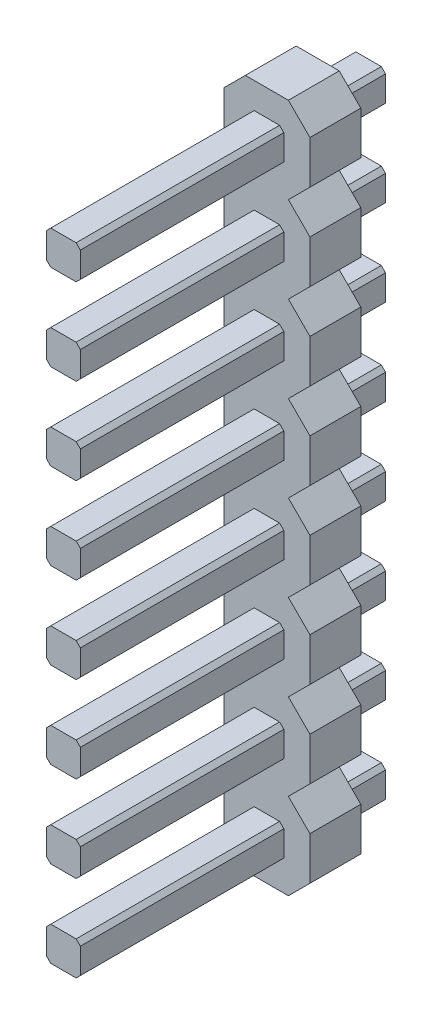
from build123d import *

# Parameters (mm, degrees)
BOSS_EXTRUDE1_DEPTH      = 1.5
BOSS_EXTRUDE2_DEPTH      = 6
BOSS_EXTRUDE2_DEPTH_BACK = 3


with BuildPart() as part:
    # Sketch1 → Boss-Extrude1 (new body)
    with BuildSketch(Plane.XY):
        Polygon((-0.635, 10.16), (0.635, 10.16), (1.27, 9.525), (1.27, 8.255), (0.635, 7.62), (1.27, 6.985), (1.27, 5.715), (0.635, 5.08), (1.27, 4.445), (1.27, 3.175), (0.635, 2.54), (1.27, 1.905), (1.27, 0.635), (0.635, 0), (1.27, -0.635), (1.27, -1.905), (0.635, -2.54), (1.27, -3.175), (1.27, -4.445), (0.635, -5.08), (1.27, -5.715), (1.27, -6.985), (0.635, -7.62), (1.27, -8.255), (1.27, -9.525), (0.635, -10.16), (-0.635, -10.16), (-1.27, -9.525), (-1.27, -8.255), (-0.635, -7.62), (-1.27, -6.985), (-1.27, -5.715), (-0.635, -5.08), (-1.27, -4.445), (-1.27, -3.175), (-0.635, -2.54), (-1.27, -1.905), (-1.27, -0.635), (-0.635, 0), (-1.27, 0.635), (-1.27, 1.905), (-0.635, 2.54), (-1.27, 3.175), (-1.27, 4.445), (-0.635, 5.08), (-1.27, 5.715), (-1.27, 6.985), (-0.635, 7.62), (-1.27, 8.255), (-1.27, 9.525), align=None)
    extrude(amount=BOSS_EXTRUDE1_DEPTH)

    # Sketch2 → Boss-Extrude2 (add, two sides: drawn at the far end of the back side and taken through both)
    with BuildSketch(Plane.XY.offset(1.5).offset(-BOSS_EXTRUDE2_DEPTH_BACK)):
        Polygon((0.375, 9.39), (0.5, 9.265), (0.5, 8.515), (0.375, 8.39), (-0.375, 8.39), (-0.5, 8.515), (-0.5, 9.265), (-0.375, 9.39), align=None)
        Polygon((0.375, 6.85), (0.5, 6.725), (0.5, 5.975), (0.375, 5.85), (-0.375, 5.85), (-0.5, 5.975), (-0.5, 6.725), (-0.375, 6.85), align=None)
        Polygon((0.375, 4.31), (0.5, 4.185), (0.5, 3.435), (0.375, 3.31), (-0.375, 3.31), (-0.5, 3.435), (-0.5, 4.185), (-0.375, 4.31), align=None)
        Polygon((0.375, 1.77), (0.5, 1.645), (0.5, 0.895), (0.375, 0.77), (-0.375, 0.77), (-0.5, 0.895), (-0.5, 1.645), (-0.375, 1.77), align=None)
        Polygon((0.375, -0.77), (0.5, -0.895), (0.5, -1.645), (0.375, -1.77), (-0.375, -1.77), (-0.5, -1.645), (-0.5, -0.895), (-0.375, -0.77), align=None)
        Polygon((0.375, -3.31), (0.5, -3.435), (0.5, -4.185), (0.375, -4.31), (-0.375, -4.31), (-0.5, -4.185), (-0.5, -3.435), (-0.375, -3.31), align=None)
        Polygon((0.375, -5.85), (0.5, -5.975), (0.5, -6.725), (0.375, -6.85), (-0.375, -6.85), (-0.5, -6.725), (-0.5, -5.975), (-0.375, -5.85), align=None)
        Polygon((0.375, -8.39), (0.5, -8.515), (0.5, -9.265), (0.375, -9.39), (-0.375, -9.39), (-0.5, -9.265), (-0.5, -8.515), (-0.375, -8.39), align=None)
    extrude(amount=BOSS_EXTRUDE2_DEPTH + BOSS_EXTRUDE2_DEPTH_BACK)


solid = part.part
